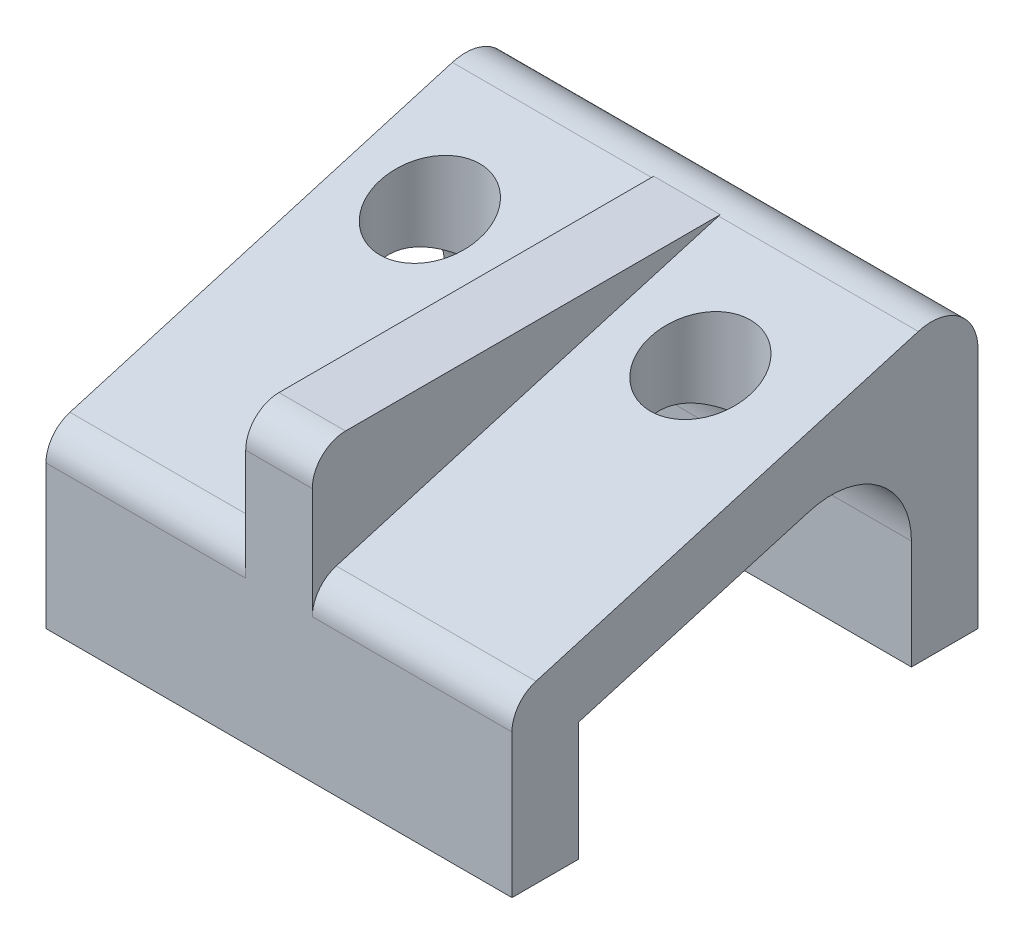
from build123d import *

# Parameters (mm, degrees)
BOSS_EXTRUDE1_DEPTH = 35
BOSS_EXTRUDE2_REACH = 91.5
SKETCH4_W           = 9.999142244
SKETCH4_H           = 17.913024492
CUT_EXTRUDE1_REACH  = 91.5
SKETCH6_R           = 7.5
FILLET2_R           = 5


with BuildPart() as part:
    # Sketch2 → Boss-Extrude1 (new, symmetric)
    with BuildSketch(Plane(origin=(0, 0, 0), x_dir=(0, 0, -1), z_dir=(1, 0, 0))):
        with BuildLine():
            Line((0, 25.295092448), (0, 0))
            Line((0, 0), (10, 0))
            Line((10, 0), (10, 17.831828992))
            Line((10, 17.831828992), (44.647504272, 27.912868223))
            ThreePointArc((44.647504272, 27.912868223), (55.203126101, 25.988336757), (60, 16.390682129))
            Line((60, 16.390682129), (60, 0))
            Line((60, 0), (70, 0))
            Line((70, 0), (70, 36.418950493))
            ThreePointArc((70, 36.418950493), (67.19828686, 42.020234938), (61.035889303, 43.137750175))
            Line((61.035889303, 43.137750175), (0, 25.295092448))
        make_face()
    extrude(amount=BOSS_EXTRUDE1_DEPTH, both=True)

    # Sketch4 → Boss-Extrude2 (add, up to next)
    with BuildSketch(Plane.XY, mode=Mode.PRIVATE) as boss_extrude2_sk1:
        with Locations((0, 34.251604694)):
            Rectangle(SKETCH4_W, SKETCH4_H)
    boss_extrude2_tool1 = extrude(boss_extrude2_sk1.sketch, amount=-BOSS_EXTRUDE2_REACH, mode=Mode.PRIVATE) - part.part
    add(boss_extrude2_tool1.solids().sort_by_distance((0, 34.251605, 0))[0])

    # Cut-Extrude1: up to this plane
    cut_extrude1_end = Plane(origin=(35, 43.137750175, -61.035889303), z_dir=(0, -0.9598285260414122, -0.280587242399169))
    # Sketch6 → Cut-Extrude1 (cut, up to the surface)
    with BuildSketch(Plane(origin=(0, 0, 0), x_dir=(1, 0, 0), z_dir=(0, 1, 0)), mode=Mode.PRIVATE) as cut_extrude1_sk1:
        with Locations(Location((18.359997259, 44.938878516, 0), (0, 0, 182.226493381))):
            Circle(SKETCH6_R)
    cut_extrude1_tool1 = split(extrude(cut_extrude1_sk1.sketch, amount=CUT_EXTRUDE1_REACH, mode=Mode.PRIVATE), bisect_by=cut_extrude1_end, keep=Keep.BOTH, mode=Mode.PRIVATE)
    add(cut_extrude1_tool1.solids().sort_by_distance((18.359997, 0, -44.938879))[0], mode=Mode.SUBTRACT)
    # Sketch6 → Cut-Extrude1 (cut, up to the surface)
    with BuildSketch(Plane(origin=(0, 0, 0), x_dir=(1, 0, 0), z_dir=(0, 1, 0)), mode=Mode.PRIVATE) as cut_extrude1_sk2:
        with Locations(Location((-22.276796675, 44.938878516, 0), (0, 0, 182.226493381))):
            Circle(SKETCH6_R)
    cut_extrude1_tool2 = split(extrude(cut_extrude1_sk2.sketch, amount=CUT_EXTRUDE1_REACH, mode=Mode.PRIVATE), bisect_by=cut_extrude1_end, keep=Keep.BOTH, mode=Mode.PRIVATE)
    add(cut_extrude1_tool2.solids().sort_by_distance((-22.276797, 0, -44.938879))[0], mode=Mode.SUBTRACT)

    # Fillet2
    fillet2_edges = [part.edges().sort_by_distance(p)[0] for p in [
        (19.999785561, 25.295092448, 0),
        (-19.999785561, 25.295092448, 0),
        (0, 43.20811694, 0),
    ]]
    fillet(fillet2_edges, radius=FILLET2_R)


solid = part.part
